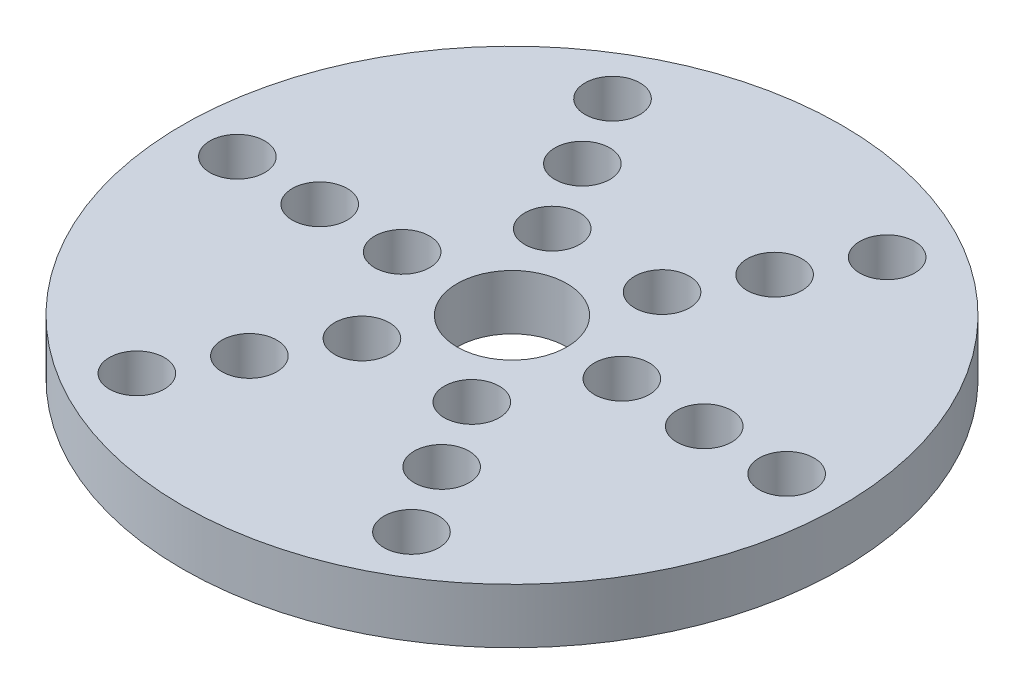
from build123d import *

# Parameters (mm, degrees)
SKETCH1_R           = 60
SKETCH1_R_2         = 10
SKETCH1_R_3         = 5
BOSS_EXTRUDE1_DEPTH = 10


with BuildPart() as part:
    # Sketch1 → Boss-Extrude1 (new body)
    with BuildSketch(Plane(origin=(0, 0, 0), x_dir=(1, 0, 0), z_dir=(0, 1, 0))):
        with Locations(Location((0, 0, 0), (0, 0, 270))):
            Circle(SKETCH1_R)
        with Locations(Location((0, 0, 0), (0, 0, 270))):
            Circle(SKETCH1_R_2, mode=Mode.SUBTRACT)
        with Locations(Location((20, 0, 0), (0, 0, 270))):
            Circle(SKETCH1_R_3, mode=Mode.SUBTRACT)
        with Locations(Location((35, 0, 0), (0, 0, 270))):
            Circle(SKETCH1_R_3, mode=Mode.SUBTRACT)
        with Locations(Location((50, 0, 0), (0, 0, 270))):
            Circle(SKETCH1_R_3, mode=Mode.SUBTRACT)
        with Locations(Location((10, -17.320508076, 0), (0, 0, 270))):
            Circle(SKETCH1_R_3, mode=Mode.SUBTRACT)
        with Locations(Location((17.5, -30.310889132, 0), (0, 0, 270))):
            Circle(SKETCH1_R_3, mode=Mode.SUBTRACT)
        with Locations(Location((25, -43.301270189, 0), (0, 0, 270))):
            Circle(SKETCH1_R_3, mode=Mode.SUBTRACT)
        with Locations(Location((-10, -17.320508076, 0), (0, 0, 270))):
            Circle(SKETCH1_R_3, mode=Mode.SUBTRACT)
        with Locations(Location((-17.5, -30.310889132, 0), (0, 0, 270))):
            Circle(SKETCH1_R_3, mode=Mode.SUBTRACT)
        with Locations(Location((-25, -43.301270189, 0), (0, 0, 270))):
            Circle(SKETCH1_R_3, mode=Mode.SUBTRACT)
        with Locations(Location((-20, 0, 0), (0, 0, 270))):
            Circle(SKETCH1_R_3, mode=Mode.SUBTRACT)
        with Locations(Location((-35, 0, 0), (0, 0, 270))):
            Circle(SKETCH1_R_3, mode=Mode.SUBTRACT)
        with Locations(Location((-50, 0, 0), (0, 0, 270))):
            Circle(SKETCH1_R_3, mode=Mode.SUBTRACT)
        with Locations(Location((-10, 17.320508076, 0), (0, 0, 270))):
            Circle(SKETCH1_R_3, mode=Mode.SUBTRACT)
        with Locations(Location((-17.5, 30.310889132, 0), (0, 0, 270))):
            Circle(SKETCH1_R_3, mode=Mode.SUBTRACT)
        with Locations(Location((-25, 43.301270189, 0), (0, 0, 270))):
            Circle(SKETCH1_R_3, mode=Mode.SUBTRACT)
        with Locations(Location((10, 17.320508076, 0), (0, 0, 270))):
            Circle(SKETCH1_R_3, mode=Mode.SUBTRACT)
        with Locations(Location((17.5, 30.310889132, 0), (0, 0, 270))):
            Circle(SKETCH1_R_3, mode=Mode.SUBTRACT)
        with Locations(Location((25, 43.301270189, 0), (0, 0, 270))):
            Circle(SKETCH1_R_3, mode=Mode.SUBTRACT)
    extrude(amount=BOSS_EXTRUDE1_DEPTH)


solid = part.part
